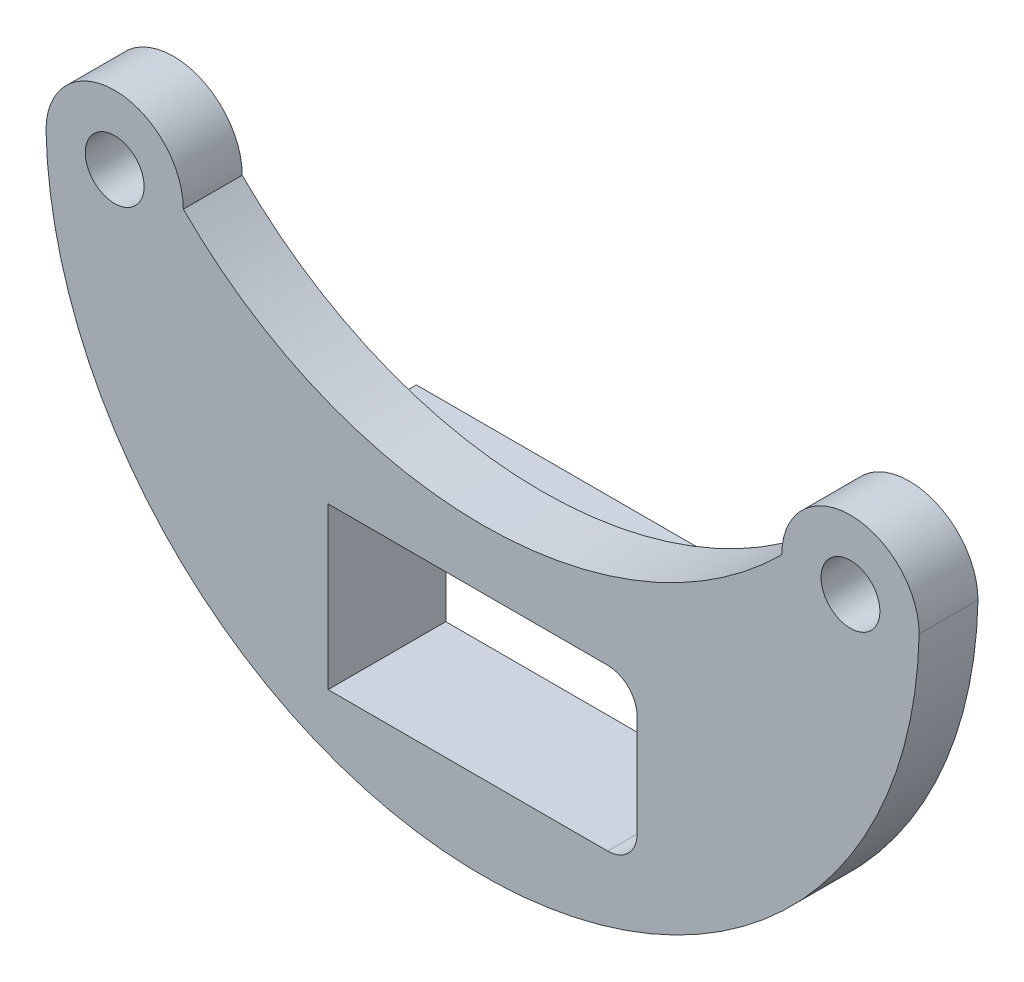
from build123d import *

# Parameters (mm, degrees)
CROQUIS1_R              = 1.5
SALIENTE_EXTRUIR1_DEPTH = 3
SALIENTE_EXTRUIR2_START = 3
CROQUIS2_W              = 18.75
CROQUIS2_H              = 11.2
SALIENTE_EXTRUIR2_DEPTH = 3


with BuildPart() as part:
    # Croquis1 → Saliente-Extruir1 (new body)
    with BuildSketch(Plane.XY):
        with BuildLine():
            ThreePointArc((-30.120896804, 5.459799134), (-45.370896804, -0.856957692), (-60.620896804, 5.459799134))
            ThreePointArc((-60.620896804, 5.459799134), (-64.120896804, 8.959799134), (-67.620896804, 5.459799134))
            ThreePointArc((-67.620896804, 5.459799134), (-67.618884854, 5.372400085), (-67.616529597, 5.285009614))
            ThreePointArc((-67.616529597, 5.285009614), (-45.370896804, -16.326653786), (-23.125264011, 5.285009614))
            ThreePointArc((-23.125264011, 5.285009614), (-23.122908754, 5.372400085), (-23.120896804, 5.459799134))
            ThreePointArc((-23.120896804, 5.459799134), (-26.620896804, 8.959799134), (-30.120896804, 5.459799134))
        make_face()
        with BuildLine():
            Line((-53.245896804, -3.856957692), (-45.370896804, -3.856957692))
            Line((-45.370896804, -3.856957692), (-38.995896804, -3.856957692))
            ThreePointArc((-38.995896804, -3.856957692), (-37.935236632, -4.296297521), (-37.495896804, -5.356957692))
            Line((-37.495896804, -5.356957692), (-37.495896804, -10.556957692))
            ThreePointArc((-37.495896804, -10.556957692), (-37.935236632, -11.617617864), (-38.995896804, -12.056957692))
            Line((-38.995896804, -12.056957692), (-53.245896804, -12.056957692))
            Line((-53.245896804, -12.056957692), (-53.245896804, -3.856957692))
        make_face(mode=Mode.SUBTRACT)
        with Locations((-64.120896804, 5.459799134)):
            Circle(CROQUIS1_R, mode=Mode.SUBTRACT)
        with Locations((-26.620896804, 5.459799134)):
            Circle(CROQUIS1_R, mode=Mode.SUBTRACT)
    extrude(amount=SALIENTE_EXTRUIR1_DEPTH)

    # Croquis2 → Saliente-Extruir2 (add)
    with BuildSketch(Plane(origin=(0, 0, 0), x_dir=(-1, 0, 0), z_dir=(0, 0, -1)).offset(SALIENTE_EXTRUIR2_START)):
        with Locations((45.370896804, -7.956957692)):
            Rectangle(CROQUIS2_W, CROQUIS2_H)
        with BuildLine():
            Line((38.995896804, -12.056957692), (53.245896804, -12.056957692))
            Line((53.245896804, -12.056957692), (53.245896804, -3.856957692))
            Line((53.245896804, -3.856957692), (38.995896804, -3.856957692))
            ThreePointArc((38.995896804, -3.856957692), (37.935236632, -4.296297521), (37.495896804, -5.356957692))
            Line((37.495896804, -5.356957692), (37.495896804, -10.556957692))
            ThreePointArc((37.495896804, -10.556957692), (37.935236632, -11.617617864), (38.995896804, -12.056957692))
        make_face(mode=Mode.SUBTRACT)
    extrude(amount=-SALIENTE_EXTRUIR2_DEPTH)


solid = part.part
